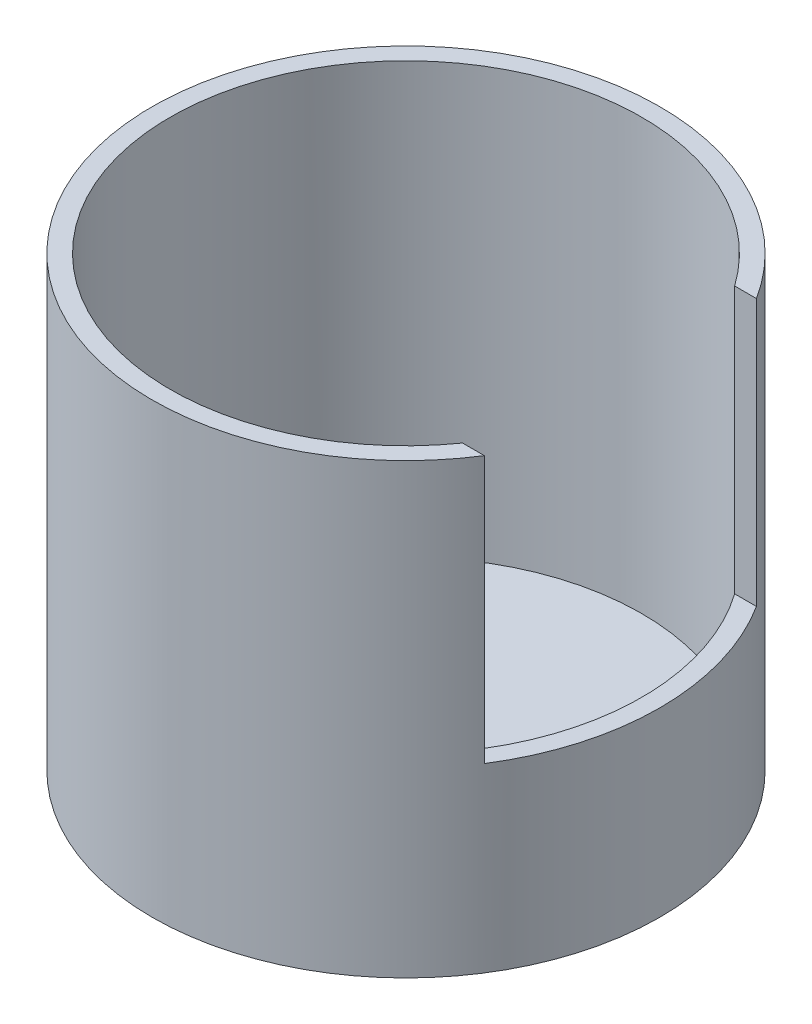
from build123d import *

# Parameters (mm, degrees)
SKETCH1_R           = 14
BOSS_EXTRUDE1_DEPTH = 24.7
SHELL1_T            = -1
SKETCH2_W           = 15
SKETCH2_H           = 14.7
CUT_EXTRUDE1_DEPTH  = 24.7


with BuildPart() as part:
    # Sketch1 → Boss-Extrude1 (new body)
    with BuildSketch(Plane(origin=(0, 0, 0), x_dir=(1, 0, 0), z_dir=(0, 1, 0))):
        with Locations(Location((0, 0, 0), (0, 0, 270))):
            Circle(SKETCH1_R)
    extrude(amount=BOSS_EXTRUDE1_DEPTH)

    # Shell1
    shell1_openings = [part.faces().sort_by_distance(p)[0] for p in [
        (0, 24.7, 0),
    ]]
    offset(amount=SHELL1_T, openings=shell1_openings, kind=Kind.INTERSECTION)

    # Sketch2 → Cut-Extrude1 (cut)
    with BuildSketch(Plane(origin=(0, 0, 0), x_dir=(0, 0, -1), z_dir=(1, 0, 0))):
        with Locations((0, 17.35)):
            Rectangle(SKETCH2_W, SKETCH2_H)
    extrude(amount=CUT_EXTRUDE1_DEPTH, mode=Mode.SUBTRACT)


solid = part.part
